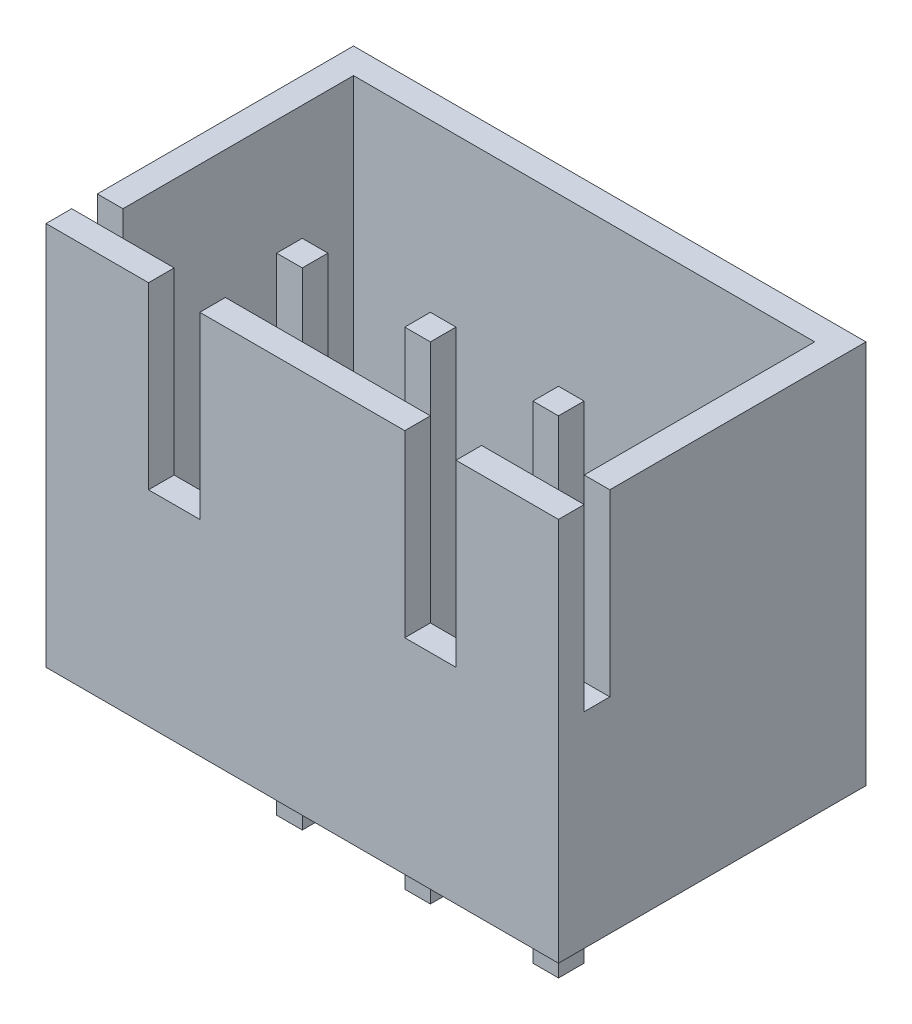
from build123d import *

# Parameters (mm, degrees)
SKETCH_1_W           = 10
SKETCH_1_H           = 6
EXTRUDE_1_DEPTH      = 7.5
SHELL_1_T            = -0.5
SKETCH_2_W           = 13.621733733
SKETCH_2_H           = 0.5
SKETCH_2_W_2         = 1
SKETCH_2_H_2         = 1.110036837
CUT_EXTRUDE_1_DEPTH  = 3.5
EXTRUDE_2_DEPTH      = 6.5
EXTRUDE_2_DEPTH_BACK = 3
SKETCH_3_W           = 0.5
SKETCH_3_H           = 0.5


with BuildPart() as part:
    # 草图1 → 凸台-拉伸1 (new body)
    with BuildSketch(Plane(origin=(0, 0, 0), x_dir=(1, 0, 0), z_dir=(0, 1, 0))):
        Rectangle(SKETCH_1_W, SKETCH_1_H)
    extrude(amount=EXTRUDE_1_DEPTH)

    # 抽壳1
    shell_1_openings = [part.faces().sort_by_distance(p)[0] for p in [
        (0, 7.5, 0),
    ]]
    offset(amount=SHELL_1_T, openings=shell_1_openings, kind=Kind.INTERSECTION)

    # 草图2 → 切除-拉伸1 (cut)
    with BuildSketch(Plane(origin=(0, 7.5, 0), x_dir=(1, 0, 0), z_dir=(0, 1, 0))):
        with Locations((0.222754883, -2.249)):
            Rectangle(SKETCH_2_W, SKETCH_2_H)
        with Locations((-2.5, -3.055018419)):
            Rectangle(SKETCH_2_W_2, SKETCH_2_H_2)
        with Locations((2.5, -3.055018419)):
            Rectangle(SKETCH_2_W_2, SKETCH_2_H_2)
    extrude(amount=-CUT_EXTRUDE_1_DEPTH, mode=Mode.SUBTRACT)

    # 草图3 → 凸台-拉伸2 (add, two sides: drawn at the far end of the back side and taken through both)
    with BuildSketch(Plane(origin=(0, 0.5, 0), x_dir=(1, 0, 0), z_dir=(0, 1, 0)).offset(-EXTRUDE_2_DEPTH_BACK)):
        with Locations((0, -0.5)):
            Rectangle(SKETCH_3_W, SKETCH_3_H)
        with Locations((-2.5, -0.5)):
            Rectangle(SKETCH_3_W, SKETCH_3_H)
        with Locations((2.5, -0.5)):
            Rectangle(SKETCH_3_W, SKETCH_3_H)
    extrude(amount=EXTRUDE_2_DEPTH + EXTRUDE_2_DEPTH_BACK)


solid = part.part
